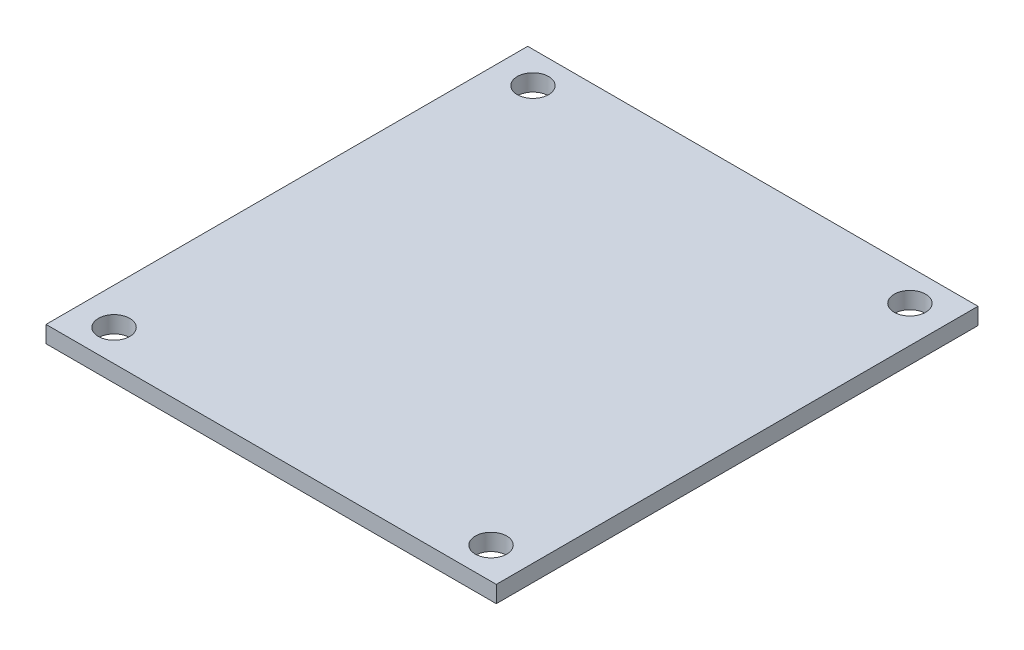
from build123d import *

# Parameters (mm, degrees)
ESQUISSE1_W        = 43
ESQUISSE1_H        = 46
ESQUISSE1_R        = 1.5
BOSS_EXTRU_1_DEPTH = 1.6


with BuildPart() as part:
    # Esquisse1 → Boss.-Extru.1 (new body)
    with BuildSketch(Plane(origin=(0, 0, 0), x_dir=(1, 0, 0), z_dir=(0, 1, 0))):
        Rectangle(ESQUISSE1_W, ESQUISSE1_H)
        with Locations(Location((-18, 20, 0), (0, 0, 270))):
            Circle(ESQUISSE1_R, mode=Mode.SUBTRACT)
        with Locations(Location((18, 20, 0), (0, 0, 270))):
            Circle(ESQUISSE1_R, mode=Mode.SUBTRACT)
        with Locations(Location((18, -20, 0), (0, 0, 270))):
            Circle(ESQUISSE1_R, mode=Mode.SUBTRACT)
        with Locations(Location((-18, -20, 0), (0, 0, 270))):
            Circle(ESQUISSE1_R, mode=Mode.SUBTRACT)
    extrude(amount=BOSS_EXTRU_1_DEPTH)


solid = part.part
